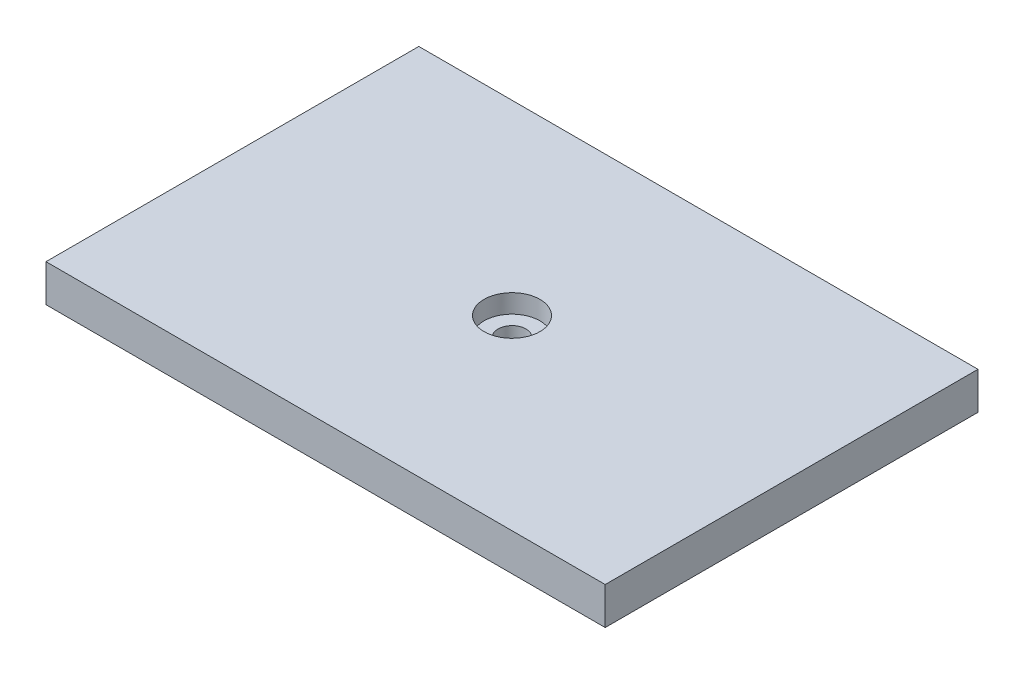
from build123d import *

# Parameters (mm, degrees)
SKETCH1_W           = 60
SKETCH1_H           = 40
BOSS_EXTRUDE1_DEPTH = 4
SKETCH2_R           = 3
CUT_EXTRUDE1_DEPTH  = 4
BOSS_EXTRUDE2_START = -2
SKETCH3_R           = 3
SKETCH3_R_2         = 1.5
BOSS_EXTRUDE2_DEPTH = 2


with BuildPart() as part:
    # Sketch1 → Boss-Extrude1 (new body)
    with BuildSketch(Plane(origin=(0, 0, 0), x_dir=(1, 0, 0), z_dir=(0, 1, 0))):
        Rectangle(SKETCH1_W, SKETCH1_H)
    extrude(amount=BOSS_EXTRUDE1_DEPTH)

    # Sketch2 → Cut-Extrude1 (cut)
    with BuildSketch(Plane(origin=(0, 4, 0), x_dir=(1, 0, 0), z_dir=(0, 1, 0))):
        with Locations(Location((0, 0, 0), (0, 0, 270))):
            Circle(SKETCH2_R)
    extrude(amount=-CUT_EXTRUDE1_DEPTH, mode=Mode.SUBTRACT)

    # Sketch3 → Boss-Extrude2 (add)
    with BuildSketch(Plane.XZ.offset(BOSS_EXTRUDE2_START)):
        with Locations(Location((0, 0, 0), (0, 0, 90))):
            Circle(SKETCH3_R)
        with Locations(Location((0, 0, 0), (0, 0, 270))):
            Circle(SKETCH3_R_2, mode=Mode.SUBTRACT)
    extrude(amount=BOSS_EXTRUDE2_DEPTH)


solid = part.part
